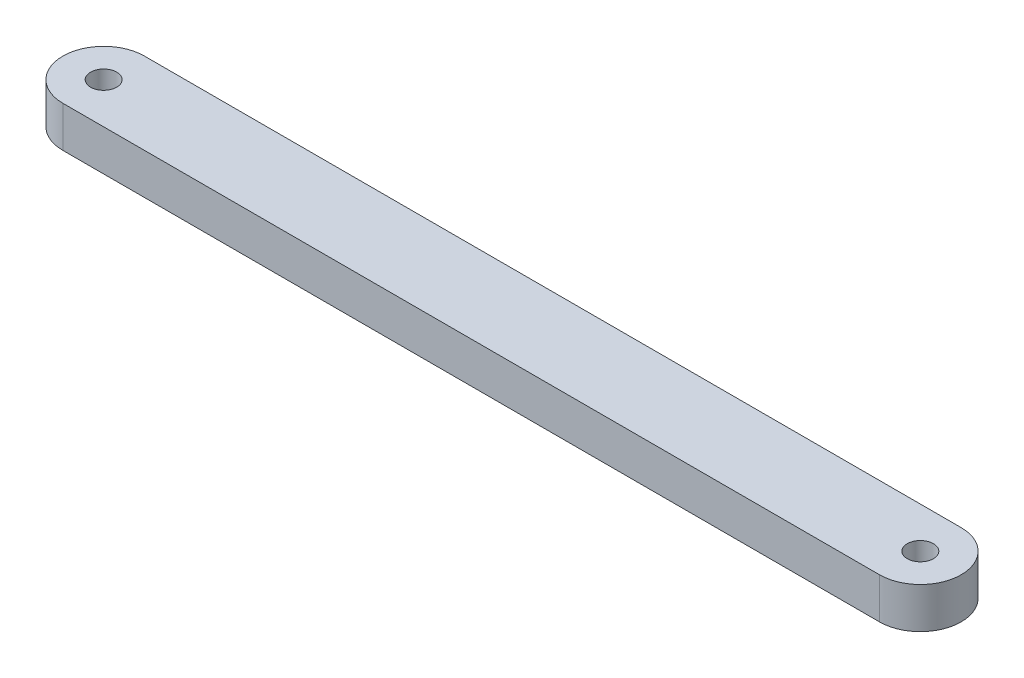
from build123d import *

# Parameters (mm, degrees)
SKETCH_1_R      = 1.6
EXTRUDE_1_DEPTH = 5


with BuildPart() as part:
    # ｽｹｯﾁ1 → ﾎﾞｽ - 押し出し1 (new body)
    with BuildSketch(Plane(origin=(0, 0, 0), x_dir=(1, 0, 0), z_dir=(0, 1, 0))):
        with BuildLine():
            Line((0, -5), (100, -5))
            ThreePointArc((100, -5), (105, 0), (100, 5))
            Line((100, 5), (0, 5))
            ThreePointArc((0, 5), (-5, 0), (0, -5))
        make_face()
        with Locations(Location((0, 0, 0), (0, 0, 270))):
            Circle(SKETCH_1_R, mode=Mode.SUBTRACT)
        with Locations(Location((100, 0, 0), (0, 0, 270))):
            Circle(SKETCH_1_R, mode=Mode.SUBTRACT)
    extrude(amount=EXTRUDE_1_DEPTH)


solid = part.part
